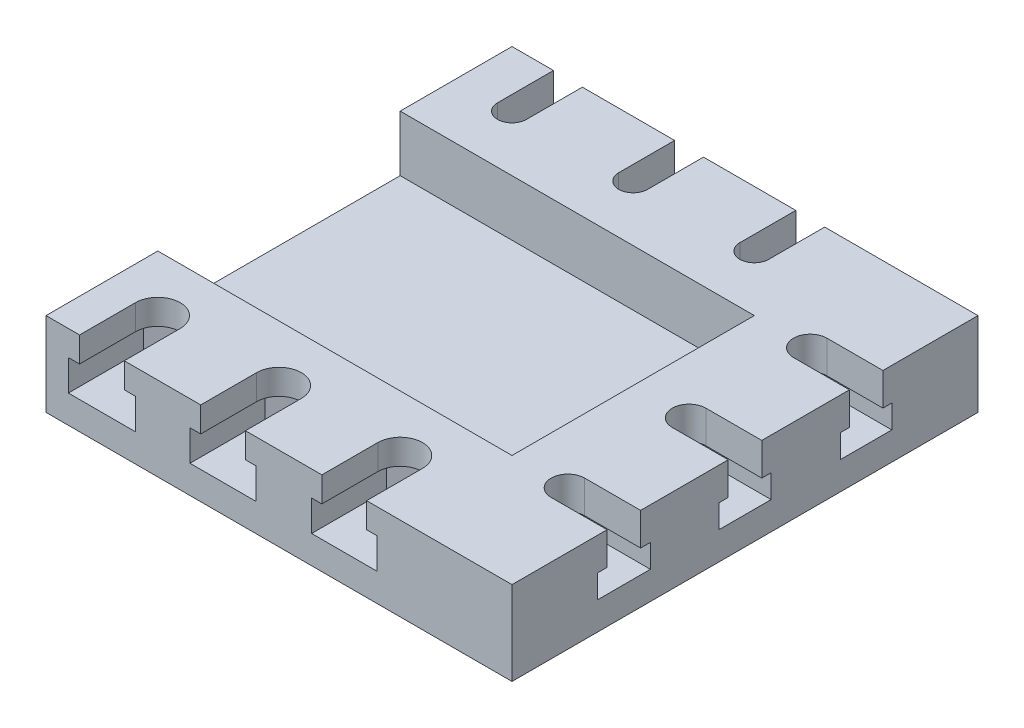
from build123d import *

# Parameters (mm, degrees)
SKETCH1_W           = 50
SKETCH1_H           = 50
BOSS_EXTRUDE1_DEPTH = 3
BOSS_EXTRUDE2_DEPTH = 6
CUT_EXTRUDE1_DEPTH  = 2.1
CUT_EXTRUDE2_DEPTH  = 2.5
CUT_EXTRUDE3_DEPTH  = 3.3
SKETCH4_R           = 1.55
SKETCH4_R_2         = 1.8
SKETCH4_R_3         = 2.4
CUT_EXTRUDE4_DEPTH  = 37.482872694
CUT_EXTRUDE5_REACH  = 38.483
SKETCH5_W           = 3.1
SKETCH5_H           = 6
SKETCH5_W_2         = 6
SKETCH5_H_2         = 3.6
SKETCH5_W_3         = 4.8


with BuildPart() as part:
    # Sketch1 → Boss-Extrude1 (new body)
    with BuildSketch(Plane(origin=(0, 0, 0), x_dir=(1, 0, 0), z_dir=(0, 1, 0))):
        Rectangle(SKETCH1_W, SKETCH1_H)
    extrude(amount=BOSS_EXTRUDE1_DEPTH)

    # Sketch2 → Boss-Extrude2 (add)
    with BuildSketch(Plane(origin=(0, 3, 0), x_dir=(1, 0, 0), z_dir=(0, 1, 0))):
        Polygon((-13, 13), (-25, 13), (-25, 25), (25, 25), (25, -25), (-25, -25), (-25, -13), (-13, -13), (13, -13), (13, 13), align=None)
    extrude(amount=BOSS_EXTRUDE2_DEPTH)

    # Sketch3 → Cut-Extrude1 (cut)
    with BuildSketch(Plane(origin=(0, 3, 0), x_dir=(1, 0, 0), z_dir=(0, 1, 0))):
        Polygon((-21.5, 25), (-16.5, 25), (-16.5, 20.443375673), (-16.5, 17.556624327), (-19, 16.113248654), (-21.5, 17.556624327), (-21.5, 20.443375673), align=None)
        Polygon((-8.55, 25), (-3.45, 25), (-3.45, 20.472243186), (-3.45, 17.527756814), (-6, 16.055513627), (-8.55, 17.527756814), (-8.55, 20.472243186), align=None)
        Polygon((4.4, 25), (9.6, 25), (9.6, 20.5011107), (9.6, 17.4988893), (7, 15.9977786), (4.4, 17.4988893), (4.4, 20.5011107), align=None)
    extrude(amount=CUT_EXTRUDE1_DEPTH, mode=Mode.SUBTRACT)

    # Sketch3<3> → Cut-Extrude2 (cut)
    with BuildSketch(Plane(origin=(0, 3, 0), x_dir=(1, 0, 0), z_dir=(0, 1, 0))):
        Polygon((25, 15.75), (25, 10.25), (20.58771324, 10.25), (17.41228676, 10.25), (15.824573519, 13), (17.41228676, 15.75), (20.58771324, 15.75), align=None)
        Polygon((25, 2.8), (25, -2.8), (20.616580754, -2.8), (17.383419246, -2.8), (15.766838493, 0), (17.383419246, 2.8), (20.616580754, 2.8), align=None)
        Polygon((25, -10.15), (25, -15.85), (20.645448267, -15.85), (17.354551733, -15.85), (15.709103466, -13), (17.354551733, -10.15), (20.645448267, -10.15), align=None)
    extrude(amount=CUT_EXTRUDE2_DEPTH, mode=Mode.SUBTRACT)

    # Sketch3<4> → Cut-Extrude3 (cut)
    with BuildSketch(Plane(origin=(0, 3, 0), x_dir=(1, 0, 0), z_dir=(0, 1, 0))):
        Polygon((-22.6, -21.078460969), (-22.6, -25), (-15.4, -25), (-15.4, -21.078460969), (-15.4, -16.921539031), (-19, -14.843078062), (-22.6, -16.921539031), align=None)
        Polygon((-9.55, -21.049593456), (-9.55, -25), (-2.45, -25), (-2.45, -21.049593456), (-2.45, -16.950406544), (-6, -14.900813089), (-9.55, -16.950406544), align=None)
        Polygon((3.5, -21.020725942), (3.5, -25), (10.5, -25), (10.5, -21.020725942), (10.5, -16.979274058), (7, -14.958548116), (3.5, -16.979274058), align=None)
    extrude(amount=CUT_EXTRUDE3_DEPTH, mode=Mode.SUBTRACT)

    # Sketch4 → Cut-Extrude4 (cut, through all)
    with BuildSketch(Plane(origin=(0, 9, 0), x_dir=(1, 0, 0), z_dir=(0, 1, 0))):
        with Locations(Location((-19, 19, 0), (0, 0, 270))):
            Circle(SKETCH4_R)
        with Locations(Location((-6, 19, 0), (0, 0, 270))):
            Circle(SKETCH4_R)
        with Locations(Location((7, 19, 0), (0, 0, 270))):
            Circle(SKETCH4_R)
        with Locations(Location((19, 13, 0), (0, 0, 270))):
            Circle(SKETCH4_R_2)
        with Locations(Location((19, 0, 0), (0, 0, 270))):
            Circle(SKETCH4_R_2)
        with Locations(Location((19, -13, 0), (0, 0, 270))):
            Circle(SKETCH4_R_2)
        with Locations(Location((7, -19, 0), (0, 0, 270))):
            Circle(SKETCH4_R_3)
        with Locations(Location((-6, -19, 0), (0, 0, 270))):
            Circle(SKETCH4_R_3)
        with Locations(Location((-19, -19, 0), (0, 0, 270))):
            Circle(SKETCH4_R_3)
    extrude(amount=-CUT_EXTRUDE4_DEPTH, mode=Mode.SUBTRACT)

    # Cut-Extrude5: up to this face of the body (flat: up to its plane)
    cut_extrude5_end = Plane(part.part.faces().sort_by_distance((-19, 3, 24.875499774))[0])
    # Sketch5 → Cut-Extrude5 (cut, up to the picked face)
    with BuildSketch(Plane(origin=(0, 9, 0), x_dir=(1, 0, 0), z_dir=(0, 1, 0)), mode=Mode.PRIVATE) as cut_extrude5_sk1:
        with Locations((-19, 22)):
            Rectangle(SKETCH5_W, SKETCH5_H)
    cut_extrude5_tool1 = split(extrude(cut_extrude5_sk1.sketch, amount=-CUT_EXTRUDE5_REACH, mode=Mode.PRIVATE), bisect_by=cut_extrude5_end, keep=Keep.BOTH, mode=Mode.PRIVATE)
    # Sketch5 → Cut-Extrude5 (cut, up to the picked face)
    with BuildSketch(Plane(origin=(0, 9, 0), x_dir=(1, 0, 0), z_dir=(0, 1, 0)), mode=Mode.PRIVATE) as cut_extrude5_sk2:
        with Locations((-6, 22)):
            Rectangle(SKETCH5_W, SKETCH5_H)
    cut_extrude5_tool2 = split(extrude(cut_extrude5_sk2.sketch, amount=-CUT_EXTRUDE5_REACH, mode=Mode.PRIVATE), bisect_by=cut_extrude5_end, keep=Keep.BOTH, mode=Mode.PRIVATE)
    # Sketch5 → Cut-Extrude5 (cut, up to the picked face)
    with BuildSketch(Plane(origin=(0, 9, 0), x_dir=(1, 0, 0), z_dir=(0, 1, 0)), mode=Mode.PRIVATE) as cut_extrude5_sk3:
        with Locations((7, 22)):
            Rectangle(SKETCH5_W, SKETCH5_H)
    cut_extrude5_tool3 = split(extrude(cut_extrude5_sk3.sketch, amount=-CUT_EXTRUDE5_REACH, mode=Mode.PRIVATE), bisect_by=cut_extrude5_end, keep=Keep.BOTH, mode=Mode.PRIVATE)
    # Sketch5 → Cut-Extrude5 (cut, up to the picked face)
    with BuildSketch(Plane(origin=(0, 9, 0), x_dir=(1, 0, 0), z_dir=(0, 1, 0)), mode=Mode.PRIVATE) as cut_extrude5_sk4:
        with Locations((22, 13)):
            Rectangle(SKETCH5_W_2, SKETCH5_H_2)
    cut_extrude5_tool4 = split(extrude(cut_extrude5_sk4.sketch, amount=-CUT_EXTRUDE5_REACH, mode=Mode.PRIVATE), bisect_by=cut_extrude5_end, keep=Keep.BOTH, mode=Mode.PRIVATE)
    # Sketch5 → Cut-Extrude5 (cut, up to the picked face)
    with BuildSketch(Plane(origin=(0, 9, 0), x_dir=(1, 0, 0), z_dir=(0, 1, 0)), mode=Mode.PRIVATE) as cut_extrude5_sk5:
        with Locations((22, 0)):
            Rectangle(SKETCH5_W_2, SKETCH5_H_2)
    cut_extrude5_tool5 = split(extrude(cut_extrude5_sk5.sketch, amount=-CUT_EXTRUDE5_REACH, mode=Mode.PRIVATE), bisect_by=cut_extrude5_end, keep=Keep.BOTH, mode=Mode.PRIVATE)
    # Sketch5 → Cut-Extrude5 (cut, up to the picked face)
    with BuildSketch(Plane(origin=(0, 9, 0), x_dir=(1, 0, 0), z_dir=(0, 1, 0)), mode=Mode.PRIVATE) as cut_extrude5_sk6:
        with Locations((22, -13)):
            Rectangle(SKETCH5_W_2, SKETCH5_H_2)
    cut_extrude5_tool6 = split(extrude(cut_extrude5_sk6.sketch, amount=-CUT_EXTRUDE5_REACH, mode=Mode.PRIVATE), bisect_by=cut_extrude5_end, keep=Keep.BOTH, mode=Mode.PRIVATE)
    # Sketch5 → Cut-Extrude5 (cut, up to the picked face)
    with BuildSketch(Plane(origin=(0, 9, 0), x_dir=(1, 0, 0), z_dir=(0, 1, 0)), mode=Mode.PRIVATE) as cut_extrude5_sk7:
        with Locations((7, -22)):
            Rectangle(SKETCH5_W_3, SKETCH5_H)
    cut_extrude5_tool7 = split(extrude(cut_extrude5_sk7.sketch, amount=-CUT_EXTRUDE5_REACH, mode=Mode.PRIVATE), bisect_by=cut_extrude5_end, keep=Keep.BOTH, mode=Mode.PRIVATE)
    # Sketch5 → Cut-Extrude5 (cut, up to the picked face)
    with BuildSketch(Plane(origin=(0, 9, 0), x_dir=(1, 0, 0), z_dir=(0, 1, 0)), mode=Mode.PRIVATE) as cut_extrude5_sk8:
        with Locations((-6, -22)):
            Rectangle(SKETCH5_W_3, SKETCH5_H)
    cut_extrude5_tool8 = split(extrude(cut_extrude5_sk8.sketch, amount=-CUT_EXTRUDE5_REACH, mode=Mode.PRIVATE), bisect_by=cut_extrude5_end, keep=Keep.BOTH, mode=Mode.PRIVATE)
    # Sketch5 → Cut-Extrude5 (cut, up to the picked face)
    with BuildSketch(Plane(origin=(0, 9, 0), x_dir=(1, 0, 0), z_dir=(0, 1, 0)), mode=Mode.PRIVATE) as cut_extrude5_sk9:
        with Locations((-19, -22)):
            Rectangle(SKETCH5_W_3, SKETCH5_H)
    cut_extrude5_tool9 = split(extrude(cut_extrude5_sk9.sketch, amount=-CUT_EXTRUDE5_REACH, mode=Mode.PRIVATE), bisect_by=cut_extrude5_end, keep=Keep.BOTH, mode=Mode.PRIVATE)
    add(cut_extrude5_tool1.solids().sort_by(Axis((-19, 9, -22), (0, -1, 0)))[0], mode=Mode.SUBTRACT)
    add(cut_extrude5_tool2.solids().sort_by(Axis((-6, 9, -22), (0, -1, 0)))[0], mode=Mode.SUBTRACT)
    add(cut_extrude5_tool3.solids().sort_by(Axis((7, 9, -22), (0, -1, 0)))[0], mode=Mode.SUBTRACT)
    add(cut_extrude5_tool4.solids().sort_by(Axis((22, 9, -13), (0, -1, 0)))[0], mode=Mode.SUBTRACT)
    add(cut_extrude5_tool5.solids().sort_by(Axis((22, 9, 0), (0, -1, 0)))[0], mode=Mode.SUBTRACT)
    add(cut_extrude5_tool6.solids().sort_by(Axis((22, 9, 13), (0, -1, 0)))[0], mode=Mode.SUBTRACT)
    add(cut_extrude5_tool7.solids().sort_by(Axis((7, 9, 22), (0, -1, 0)))[0], mode=Mode.SUBTRACT)
    add(cut_extrude5_tool8.solids().sort_by(Axis((-6, 9, 22), (0, -1, 0)))[0], mode=Mode.SUBTRACT)
    add(cut_extrude5_tool9.solids().sort_by(Axis((-19, 9, 22), (0, -1, 0)))[0], mode=Mode.SUBTRACT)


solid = part.part
